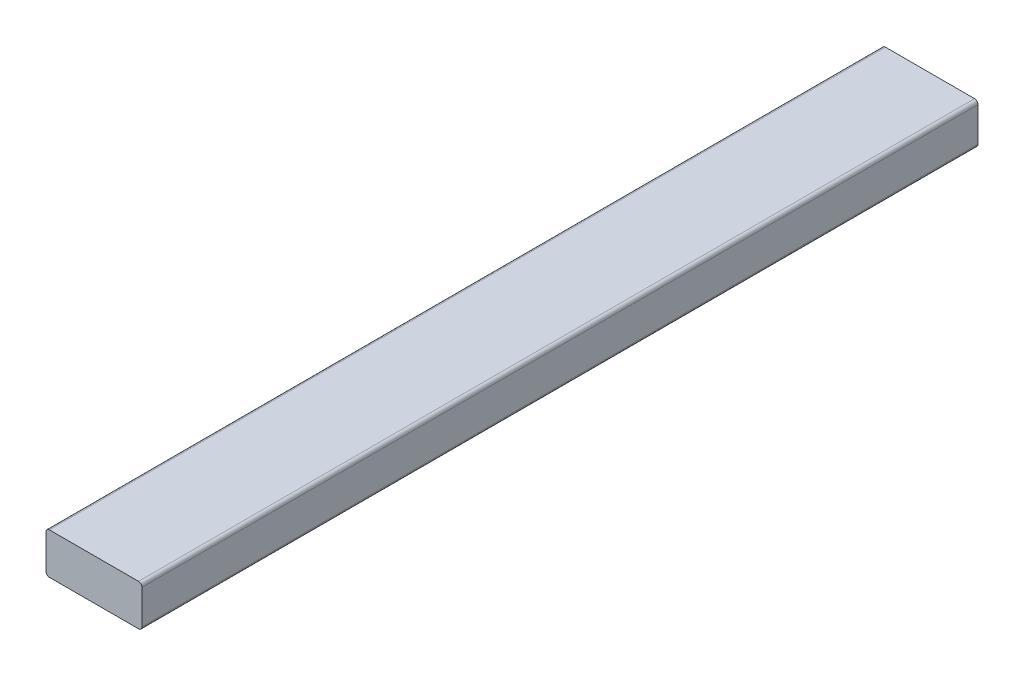
from build123d import *

# Parameters (mm, degrees)
SKETCH1_W           = 88.9
SKETCH1_H           = 38.1
BOSS_EXTRUDE1_DEPTH = 387.35
FILLET1_R           = 3.175


with BuildPart() as part:
    # Sketch1 → Boss-Extrude1 (new, symmetric)
    with BuildSketch(Plane.XY):
        Rectangle(SKETCH1_W, SKETCH1_H)
    extrude(amount=BOSS_EXTRUDE1_DEPTH, both=True)

    # Fillet1
    fillet1_edges = [part.edges().sort_by_distance(p)[0] for p in [
        (44.45, -19.05, 0),
        (-44.45, -19.05, 0),
        (-44.45, 19.05, 0),
        (44.45, 19.05, 0),
    ]]
    fillet(fillet1_edges, radius=FILLET1_R)


solid = part.part
